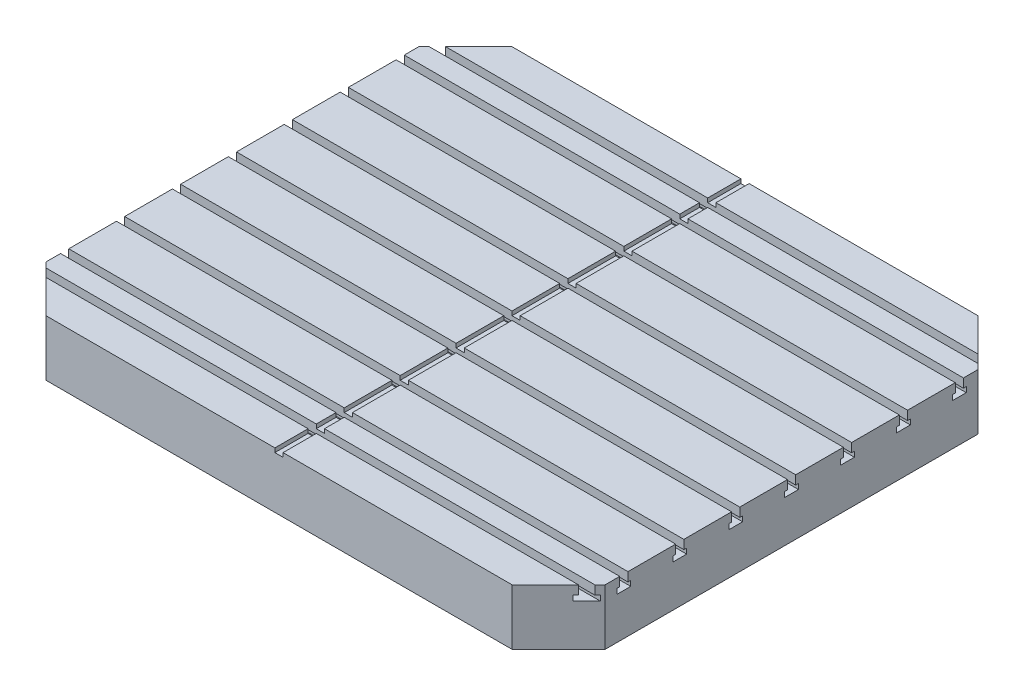
from build123d import *

# Parameters (mm, degrees)
SKETCH1_W           = 1500
SKETCH1_H           = 1250
BOSS_EXTRUDE1_DEPTH = 150
CUT_EXTRUDE1_REACH  = 1633.908
LPATTERN1_COUNT     = 4
LPATTERN1_PITCH     = 150
LPATTERN1_COL_COUNT = 4
LPATTERN1_COL_PITCH = 150
CUT_EXTRUDE2_REACH  = 1467.435
SKETCH3_W           = 22
SKETCH3_H           = 11
LPATTERN2_COUNT     = 2
LPATTERN2_PITCH     = 525
LPATTERN2_COL_COUNT = 2
LPATTERN2_COL_PITCH = 525
CHAMFER1_SIZE       = 125


with BuildPart() as part:
    # Sketch1 → Boss-Extrude1 (new body)
    with BuildSketch(Plane(origin=(0, 0, 0), x_dir=(1, 0, 0), z_dir=(0, 1, 0))):
        Rectangle(SKETCH1_W, SKETCH1_H)
    extrude(amount=-BOSS_EXTRUDE1_DEPTH)

    # Sketch2 → Cut-Extrude1 (cut, up to next)
    with BuildSketch(Plane(origin=(750, 0, 0), x_dir=(0, 0, -1), z_dir=(1, 0, 0)), mode=Mode.PRIVATE) as cut_extrude1_sk1:
        Polygon((-11, 0), (11, 0), (11, -24), (18.5, -24), (18.5, -38), (-18.5, -38), (-18.5, -24), (-11, -24), align=None)
    cut_extrude1_tool1 = extrude(cut_extrude1_sk1.sketch, amount=-CUT_EXTRUDE1_REACH, mode=Mode.PRIVATE) & part.part
    cut_extrude1 = cut_extrude1_tool1.solids().sort_by_distance((750, -21.409178, 0))[0]
    add(cut_extrude1, mode=Mode.SUBTRACT)

    # LPattern1: Cut-Extrude1 ×4
    with Locations(*[(0, 0, -i * LPATTERN1_PITCH) for i in range(1, LPATTERN1_COUNT)]):
        add(cut_extrude1, mode=Mode.SUBTRACT)

    # LPattern1 col: Cut-Extrude1 ×4
    with Locations(*[(0, 0, i * LPATTERN1_COL_PITCH) for i in range(1, LPATTERN1_COL_COUNT)]):
        add(cut_extrude1, mode=Mode.SUBTRACT)

    # Cut-Extrude2: up to this face of the body (flat: up to its plane)
    cut_extrude2_end = Plane(part.part.faces().sort_by_distance((0, -75, 625))[0])
    # Sketch3 → Cut-Extrude2 (cut, up to the picked face)
    with BuildSketch(Plane(origin=(0, 0, -625), x_dir=(-1, 0, 0), z_dir=(0, 0, -1)), mode=Mode.PRIVATE) as cut_extrude2_sk1:
        with Locations((0, -5.5)):
            Rectangle(SKETCH3_W, SKETCH3_H)
    cut_extrude2_tool1 = split(extrude(cut_extrude2_sk1.sketch, amount=-CUT_EXTRUDE2_REACH, mode=Mode.PRIVATE), bisect_by=cut_extrude2_end, keep=Keep.BOTH, mode=Mode.PRIVATE)
    add(cut_extrude2_tool1.solids().sort_by(Axis((0, -5.5, -625), (0, 0, 1)))[0], mode=Mode.SUBTRACT)

    # LPattern2: Cut-Extrude1 ×2
    with Locations(*[(0, 0, -i * LPATTERN2_PITCH) for i in range(1, LPATTERN2_COUNT)]):
        add(cut_extrude1, mode=Mode.SUBTRACT)

    # LPattern2 col: Cut-Extrude1 ×2
    with Locations(*[(0, 0, i * LPATTERN2_COL_PITCH) for i in range(1, LPATTERN2_COL_COUNT)]):
        add(cut_extrude1, mode=Mode.SUBTRACT)

    # Chamfer1
    chamfer1_edges = [part.edges().sort_by_distance(p)[0] for p in [
        (-750, -75, 625),
        (-750, -75, -625),
        (750, -75, -625),
        (750, -75, 625),
    ]]
    chamfer(chamfer1_edges, length=CHAMFER1_SIZE)


solid = part.part
